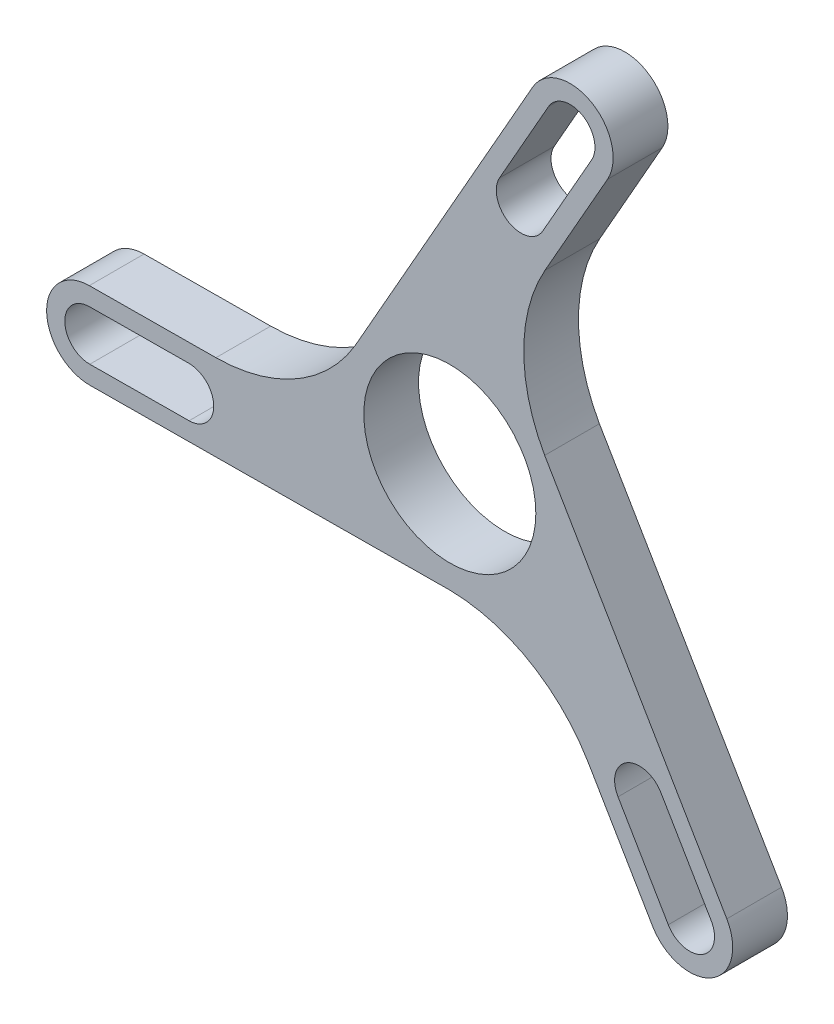
from build123d import *

# Parameters (mm, degrees)
SKETCH1_R           = 11
BOSS_EXTRUDE2_DEPTH = 7


with BuildPart() as part:
    # Sketch1 → Boss-Extrude2 (new body)
    with BuildSketch(Plane.XY):
        with BuildLine():
            ThreePointArc((20.169463689, 41.588983826), (18.10306117, 49.087649082), (10.604395914, 47.021246564))
            Line((10.604395914, 47.021246564), (-12.118876528, 7.010361333))
            ThreePointArc((-12.118876528, 7.010361333), (-19.668266357, -0.440838827), (-29.907048562, -3.212302261))
            Line((-29.907048562, -3.212302261), (-46.101848355, -3.327223978))
            ThreePointArc((-46.101848355, -3.327223978), (-51.562681703, -8.866113681), (-46.023791999, -14.326947029))
            Line((-46.023791999, -14.326947029), (-0.01171274, -14.000435605))
            ThreePointArc((-0.01171274, -14.000435605), (10.215910802, -16.8127989), (17.735459644, -24.294112676))
            Line((17.735459644, -24.294112676), (25.932384666, -38.261759848))
            ThreePointArc((25.932384666, -38.261759848), (33.459620532, -40.221535401), (35.419396085, -32.694299535))
            Line((35.419396085, -32.694299535), (12.130589268, 6.990074273))
            ThreePointArc((12.130589268, 6.990074273), (9.452355555, 17.253637727), (12.171588918, 27.506414937))
            Line((12.171588918, 27.506414937), (20.169463689, 41.588983826))
        make_face()
        with BuildLine():
            Line((6.354309168, 34.829758236), (12.626103421, 45.873063758))
            ThreePointArc((12.626103421, 45.873063758), (16.954878364, 47.065941576), (18.147756182, 42.737166632))
            Line((18.147756182, 42.737166632), (11.875961929, 31.69386111))
            ThreePointArc((11.875961929, 31.69386111), (7.547186985, 30.500983292), (6.354309168, 34.829758236))
        make_face(mode=Mode.SUBTRACT)
        with BuildLine():
            ThreePointArc((-46.040290274, -12.002005566), (-49.23774024, -8.849615406), (-46.08535008, -5.652165441))
            Line((-46.08535008, -5.652165441), (-33.38566983, -5.56204583))
            ThreePointArc((-33.38566983, -5.56204583), (-30.188219864, -8.71443599), (-33.340610024, -11.911885955))
            Line((-33.340610024, -11.911885955), (-46.040290274, -12.002005566))
        make_face(mode=Mode.SUBTRACT)
        Circle(SKETCH1_R, mode=Mode.SUBTRACT)
        with BuildLine():
            ThreePointArc((33.414186854, -33.871058192), (32.282861875, -38.216326169), (27.937593898, -37.085001191))
            Line((27.937593898, -37.085001191), (21.509707901, -26.13181528))
            ThreePointArc((21.509707901, -26.13181528), (22.641032879, -21.786547303), (26.986300856, -22.917872281))
            Line((26.986300856, -22.917872281), (33.414186854, -33.871058192))
        make_face(mode=Mode.SUBTRACT)
    extrude(amount=BOSS_EXTRUDE2_DEPTH)


solid = part.part
